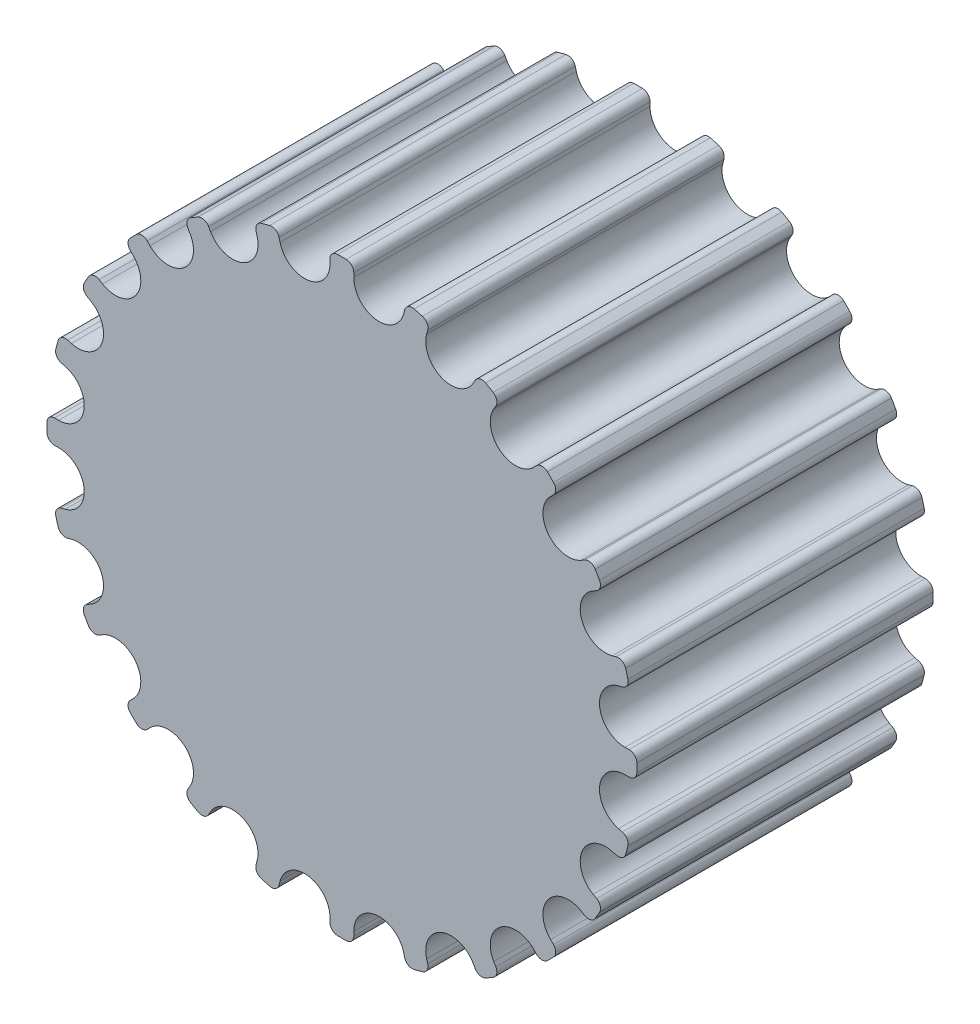
from build123d import *

# Parameters (mm, degrees)
SKETCH2_R         = 29.875
EXTRUDE1_DEPTH    = 30
EXTRUDE2_DEPTH    = 30
CIRPATTERN1_COUNT = 24


with BuildPart() as part:
    # Sketch2 → Extrude1 (new body)
    with BuildSketch(Plane.XY):
        Circle(SKETCH2_R)
    extrude(amount=EXTRUDE1_DEPTH)

    # Sketch1 → Extrude2 (cut)
    with BuildSketch(Plane.XY):
        with BuildLine():
            Line((-1.206491179, 29.085066823), (-1.202957444, 28.680140914))
            ThreePointArc((-1.202957444, 28.680140914), (-3.437407272, 26.109700424), (-6.260999022, 28.014237108))
            Line((-6.260999022, 28.014237108), (-6.362388233, 28.406280098))
            ThreePointArc((-6.362388233, 28.406280098), (-6.719671358, 28.881877013), (-7.308355692, 28.967284341))
            ThreePointArc((-7.308355692, 28.967284341), (-3.899469993, 29.619415234), (-0.437955362, 29.871789704))
            ThreePointArc((-0.437955362, 29.871789704), (-0.98447572, 29.636929843), (-1.206491179, 29.085066823))
        make_face()
    extrude2 = extrude(amount=EXTRUDE2_DEPTH, mode=Mode.SUBTRACT)

    # CirPattern1: Extrude2 ×24 about axis
    cirpattern1_axis = Axis((0, 0, 0), (0, 0, 1))
    for i in range(1, CIRPATTERN1_COUNT):
        add(extrude2.rotate(cirpattern1_axis, i * 360 / CIRPATTERN1_COUNT), mode=Mode.SUBTRACT)


solid = part.part
